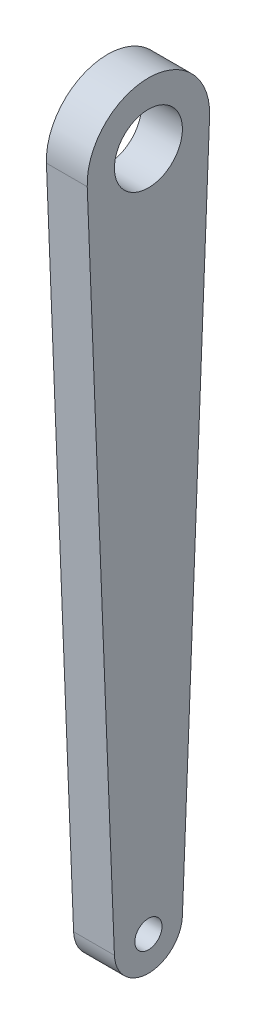
from build123d import *

# Parameters (mm, degrees)
SKETCH1_R           = 2.5
SKETCH1_R_2         = 1
BOSS_EXTRUDE1_DEPTH = 3


with BuildPart() as part:
    # Sketch1 → Boss-Extrude1 (new body)
    with BuildSketch(Plane(origin=(0, 0, 0), x_dir=(0, 0, -1), z_dir=(1, 0, 0))):
        with BuildLine():
            Line((-4.496398559, -0.18), (-2.497999199, -50.1))
            ThreePointArc((-2.497999199, -50.1), (0, -52.5), (2.497999199, -50.1))
            Line((2.497999199, -50.1), (4.496398559, -0.18))
            ThreePointArc((4.496398559, -0.18), (0, 4.5), (-4.496398559, -0.18))
        make_face()
        Circle(SKETCH1_R, mode=Mode.SUBTRACT)
        with Locations((0, -50)):
            Circle(SKETCH1_R_2, mode=Mode.SUBTRACT)
    extrude(amount=BOSS_EXTRUDE1_DEPTH)


solid = part.part
